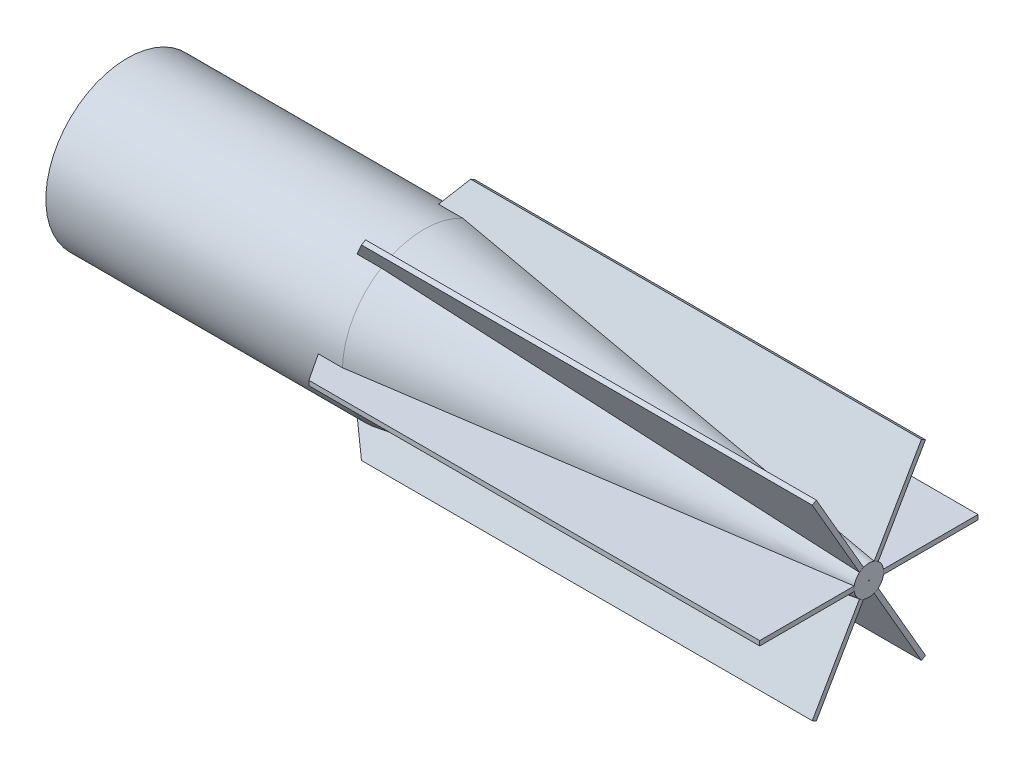
from build123d import *

# Parameters (mm, degrees)
BOSS_EXTRUDE2_DEPTH = 0.79375
CIRPATTERN1_COUNT   = 6


with BuildPart() as part:
    # Sketch1 → Revolve1 (revolve)
    with BuildSketch(Plane(origin=(0, 0, 0), x_dir=(1, 0, 0), z_dir=(0, 1, 0))):
        Polygon((-250, 0), (-150, 0), (-1, -22.35), (0, -22.35), (0, -17.5), (-150, 5), (-250, 5), align=None)
    revolve1 = revolve(axis=Axis((0, 0, 22.5), (-1, 0, 0)))

    # Sketch3 → Boss-Extrude2 (add, symmetric)
    with BuildSketch(Plane(origin=(0, 0, 0), x_dir=(1, 0, 0), z_dir=(0, 1, 0))):
        Polygon((-152, 14.3), (-158.141509434, 5), (-150, 5), (0, -17.5), (0, 14.3), align=None)
        Polygon((-158.141509434, 5), (-159.462264151, 3), (-150.149165611, 3), (-13.482498944, -17.5), (0, -17.5), (-150, 5), align=None)
    boss_extrude2 = extrude(amount=BOSS_EXTRUDE2_DEPTH, both=True)

    # CirPattern1: Revolve1, Boss-Extrude2 ×6 about axis
    cirpattern1_axis = Axis((0, 0, 22.5), (1, 0, 0))
    add([revolve1.rotate(cirpattern1_axis, i * 360 / CIRPATTERN1_COUNT) for i in range(1, CIRPATTERN1_COUNT)])
    add([boss_extrude2.rotate(cirpattern1_axis, i * 360 / CIRPATTERN1_COUNT) for i in range(1, CIRPATTERN1_COUNT)])


solid = part.part
